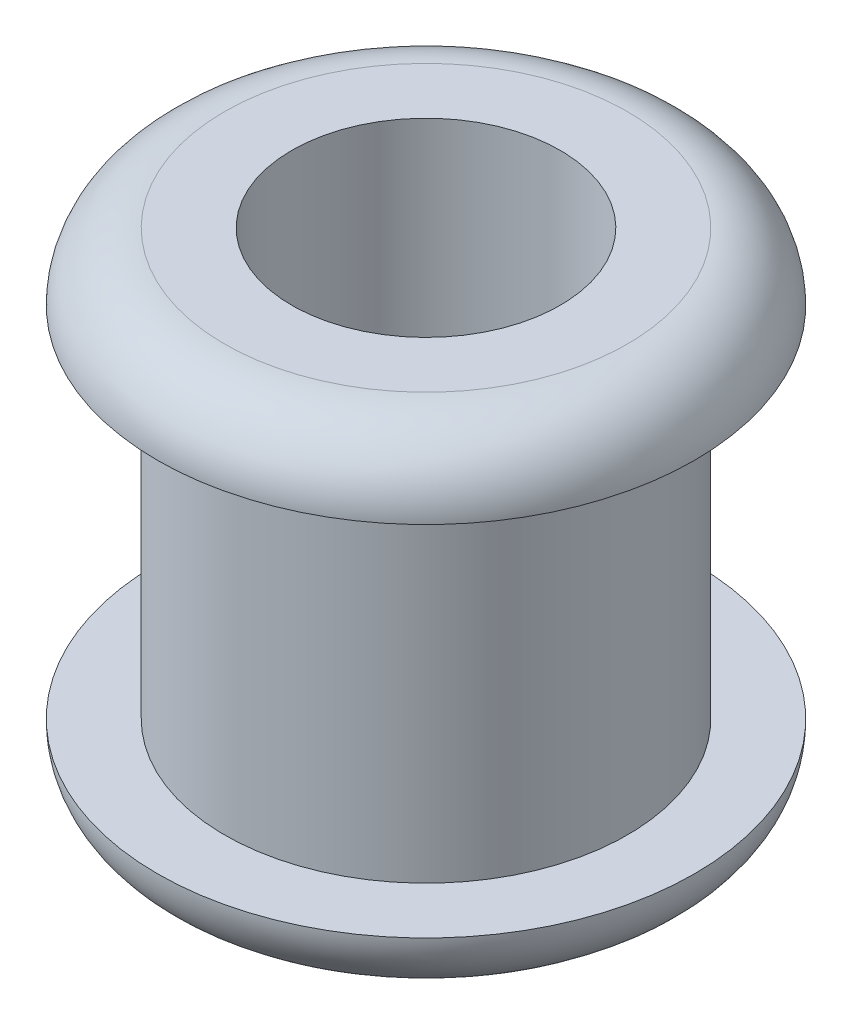
from build123d import *


with BuildPart() as part:
    # Sketch1 → Revolve1 (revolve)
    with BuildSketch(Plane.XY, mode=Mode.PRIVATE) as revolve1_sk:
        with BuildLine():
            Line((4.7625, 0), (4.7625, -17.4625))
            Line((4.7625, -17.4625), (7.14375, -17.4625))
            ThreePointArc((7.14375, -17.4625), (8.827548023, -16.765048023), (9.525, -15.08125))
            Line((9.525, -15.08125), (7.14375, -15.08125))
            Line((7.14375, -15.08125), (7.14375, -2.38125))
            Line((7.14375, -2.38125), (9.525, -2.38125))
            ThreePointArc((9.525, -2.38125), (8.827548023, -0.697451977), (7.14375, 0))
            Line((7.14375, 0), (4.7625, 0))
        make_face()
    revolve(revolve1_sk.sketch.rotate(Axis((0, 0, 0), (0, -1, 0)), 180), axis=Axis((0, 0, 0), (0, -1, 0)))


solid = part.part
